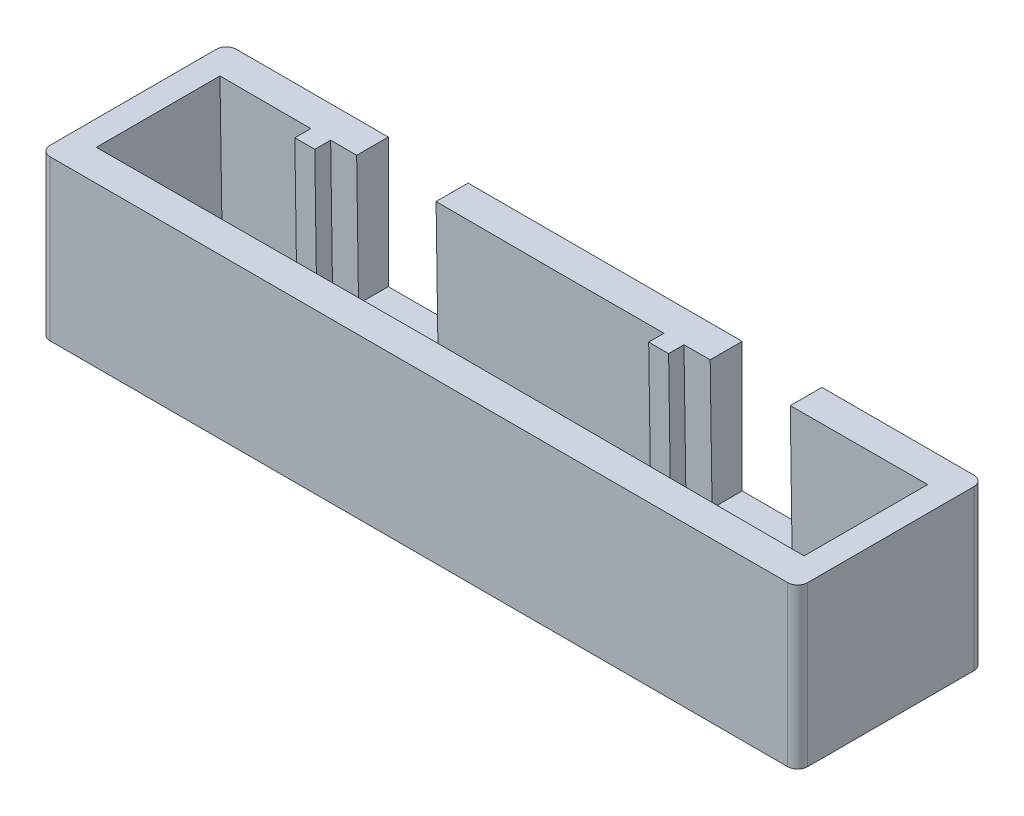
from build123d import *

# Parameters (mm, degrees)
SKETCH15_W              = 38
SKETCH15_H              = 9.34
BOSS_EXTRUDE11_DEPTH    = 1.5
SKETCH16_W              = 38
SKETCH16_H              = 9.34
BOSS_EXTRUDE12_DEPTH    = 6.5
LPATTERN2_COUNT         = 2
LPATTERN2_PITCH         = 17.75
SKETCH10_W              = 4
SKETCH10_H              = 2
CUT_EXTRUDE2_DEPTH      = 6.5
SKETCH2_W               = 0.8
SKETCH2_H               = 0.8
CUT_EXTRUDE1_DEPTH      = 21.61695676
LPATTERN1_COUNT         = 5
LPATTERN1_PITCH         = 2.54
LPATTERN1_COUNT_DIR2    = 2
LPATTERN1_PITCH_DIR2    = 2.54
MIRROR1_COPY_1_SKETCH_W = 0.8
MIRROR1_COPY_1_SKETCH_H = 0.8
MIRROR1_COPY_1_DEPTH    = 21.61695676
MIRROR1_COPY_2_SKETCH_W = 0.8
MIRROR1_COPY_2_SKETCH_H = 0.8
MIRROR1_COPY_2_DEPTH    = 21.61695676
MIRROR1_COPY_3_SKETCH_W = 0.8
MIRROR1_COPY_3_SKETCH_H = 0.8
MIRROR1_COPY_3_DEPTH    = 21.61695676
MIRROR1_COPY_4_SKETCH_W = 0.8
MIRROR1_COPY_4_SKETCH_H = 0.8
MIRROR1_COPY_4_DEPTH    = 21.61695676
MIRROR1_COPY_5_SKETCH_W = 0.8
MIRROR1_COPY_5_SKETCH_H = 0.8
MIRROR1_COPY_5_DEPTH    = 21.61695676
MIRROR1_COPY_6_SKETCH_W = 0.8
MIRROR1_COPY_6_SKETCH_H = 0.8
MIRROR1_COPY_6_DEPTH    = 21.61695676
MIRROR1_COPY_7_SKETCH_W = 0.8
MIRROR1_COPY_7_SKETCH_H = 0.8
MIRROR1_COPY_7_DEPTH    = 21.61695676
MIRROR1_COPY_8_SKETCH_W = 0.8
MIRROR1_COPY_8_SKETCH_H = 0.8
MIRROR1_COPY_8_DEPTH    = 21.61695676
MIRROR1_COPY_9_SKETCH_W = 0.8
MIRROR1_COPY_9_SKETCH_H = 0.8
MIRROR1_COPY_9_DEPTH    = 21.61695676
FILLET6_R               = 0.5


with BuildPart() as part:
    # Sketch15 → Boss-Extrude11 (new body)
    with BuildSketch(Plane(origin=(0, 0, 0), x_dir=(1, 0, 0), z_dir=(0, 1, 0))):
        Rectangle(SKETCH15_W, SKETCH15_H)
    extrude(amount=BOSS_EXTRUDE11_DEPTH)

    # Sketch16 → Boss-Extrude12 (add)
    with BuildSketch(Plane(origin=(0, 1.5, 0), x_dir=(1, 0, 0), z_dir=(0, 1, 0))):
        Rectangle(SKETCH16_W, SKETCH16_H)
    extrude(amount=BOSS_EXTRUDE12_DEPTH)

    # Sketch5 → Cut-Loft1 section 0
    with BuildSketch(Plane(origin=(0, 1.5, 0), x_dir=(1, 0, 0), z_dir=(0, 1, 0))):
        with BuildLine():
            Line((-17.75, 3.2), (-17.75, -3.2))
            add(Edge.make_bspline(
                [(-17.75, -3.2), (-14.75, -3.2), (0, -3.1), (14.75, -3.2), (17.75, -3.2)],
                knots=[0, 0, 0, 0, 0.5, 1, 1, 1, 1], degree=3))
            Line((17.75, -3.2), (17.75, 3.2))
            add(Edge.make_bspline(
                [(-17.75, 3.2), (-14.75, 3.2), (0, 3.1), (14.75, 3.2), (17.75, 3.2)],
                knots=[0, 0, 0, 0, 0.5, 1, 1, 1, 1], degree=3))
        make_face()
    # Sketch6 → Cut-Loft1 section 1
    with BuildSketch(Plane(origin=(0, 8, 0), x_dir=(1, 0, 0), z_dir=(0, 1, 0))):
        with BuildLine():
            Line((-17.75, 3.1), (-17.75, -3.1))
            add(Edge.make_bspline(
                [(-17.75, -3.1), (-11.833239437, -3.1), (0.000187784, -3), (11.832863868, -3.1), (17.75, -3.1)],
                knots=[0, 0, 0, 0, 0.5, 1, 1, 1, 1], degree=3))
            Line((17.75, -3.1), (17.75, 3.1))
            add(Edge.make_bspline(
                [(-17.75, 3.1), (-11.833239437, 3.1), (0.000187784, 3), (11.832863868, 3.1), (17.75, 3.1)],
                knots=[0, 0, 0, 0, 0.5, 1, 1, 1, 1], degree=3))
        make_face()
    loft(mode=Mode.SUBTRACT)

    # Sketch8 → Loft1 section 0
    with BuildSketch(Plane(origin=(0, 1.5, 0), x_dir=(1, 0, 0), z_dir=(0, 1, 0))):
        with BuildLine():
            Line((-13.185, 2.385934046), (-12.185, 2.385934046))
            Line((-12.185, 2.385934046), (-12.185, 3.585934046))
            Line((-12.185, 3.585934046), (-13.185, 3.585934046))
            Line((-13.185, 3.585934046), (-13.185, 2.385934046))
        make_face()
    # Sketch9 → Loft1 section 1
    with BuildSketch(Plane(origin=(0, 8, 0), x_dir=(1, 0, 0), z_dir=(0, 1, 0))):
        with BuildLine():
            Line((-13.185, 3.491779814), (-13.185, 2.291779814))
            Line((-13.185, 2.291779814), (-12.185, 2.291779814))
            Line((-12.185, 2.291779814), (-12.185, 3.491779814))
            Line((-12.185, 3.491779814), (-13.185, 3.491779814))
        make_face()
    loft1 = loft()

    # LPattern2: Loft1 ×2
    with Locations(*[(i * LPATTERN2_PITCH, 0, 0) for i in range(1, LPATTERN2_COUNT)]):
        add(loft1)

    # Sketch10 → Cut-Extrude2 (cut)
    with BuildSketch(Plane(origin=(0, 8, 0), x_dir=(1, 0, 0), z_dir=(0, 1, 0))):
        with Locations((-8.875, 3.67)):
            Rectangle(SKETCH10_W, SKETCH10_H)
        with Locations((8.875, 3.67)):
            Rectangle(SKETCH10_W, SKETCH10_H)
    extrude(amount=-CUT_EXTRUDE2_DEPTH, mode=Mode.SUBTRACT)

    # Sketch2 → Cut-Extrude1 (cut, through all)
    with BuildSketch(Plane(origin=(0, 1.5, 0), x_dir=(1, 0, 0), z_dir=(0, 1, 0))):
        with Locations((-3.795, -1.27)):
            Rectangle(SKETCH2_W, SKETCH2_H)
    cut_extrude1 = extrude(amount=-CUT_EXTRUDE1_DEPTH, mode=Mode.SUBTRACT)

    # LPattern1: Cut-Extrude1 5 × 2
    with Locations(*[(-i * LPATTERN1_PITCH, 0, -j * LPATTERN1_PITCH_DIR2) for i in range(LPATTERN1_COUNT) for j in range(LPATTERN1_COUNT_DIR2) if (i, j) != (0, 0)]):
        add(cut_extrude1, mode=Mode.SUBTRACT)

    # Mirror1: Cut-Extrude1 across plane
    add(cut_extrude1.mirror(Plane(origin=(0, 0, 0), x_dir=(0, 0, 1), z_dir=(1, 0, 0))), mode=Mode.SUBTRACT)

    # Mirror1 copy 1 sketch → Mirror1 copy 1 (cut, through all)
    with BuildSketch(Plane(origin=(0, 1.5, -2.54), x_dir=(-1, 0, 0), z_dir=(0, 1, 0))):
        with Locations((-3.795, 1.27)):
            Rectangle(MIRROR1_COPY_1_SKETCH_W, MIRROR1_COPY_1_SKETCH_H)
    extrude(amount=-MIRROR1_COPY_1_DEPTH, mode=Mode.SUBTRACT)

    # Mirror1 copy 2 sketch → Mirror1 copy 2 (cut, through all)
    with BuildSketch(Plane(origin=(2.54, 1.5, 0), x_dir=(-1, 0, 0), z_dir=(0, 1, 0))):
        with Locations((-3.795, 1.27)):
            Rectangle(MIRROR1_COPY_2_SKETCH_W, MIRROR1_COPY_2_SKETCH_H)
    extrude(amount=-MIRROR1_COPY_2_DEPTH, mode=Mode.SUBTRACT)

    # Mirror1 copy 3 sketch → Mirror1 copy 3 (cut, through all)
    with BuildSketch(Plane(origin=(2.54, 1.5, -2.54), x_dir=(-1, 0, 0), z_dir=(0, 1, 0))):
        with Locations((-3.795, 1.27)):
            Rectangle(MIRROR1_COPY_3_SKETCH_W, MIRROR1_COPY_3_SKETCH_H)
    extrude(amount=-MIRROR1_COPY_3_DEPTH, mode=Mode.SUBTRACT)

    # Mirror1 copy 4 sketch → Mirror1 copy 4 (cut, through all)
    with BuildSketch(Plane(origin=(5.08, 1.5, 0), x_dir=(-1, 0, 0), z_dir=(0, 1, 0))):
        with Locations((-3.795, 1.27)):
            Rectangle(MIRROR1_COPY_4_SKETCH_W, MIRROR1_COPY_4_SKETCH_H)
    extrude(amount=-MIRROR1_COPY_4_DEPTH, mode=Mode.SUBTRACT)

    # Mirror1 copy 5 sketch → Mirror1 copy 5 (cut, through all)
    with BuildSketch(Plane(origin=(5.08, 1.5, -2.54), x_dir=(-1, 0, 0), z_dir=(0, 1, 0))):
        with Locations((-3.795, 1.27)):
            Rectangle(MIRROR1_COPY_5_SKETCH_W, MIRROR1_COPY_5_SKETCH_H)
    extrude(amount=-MIRROR1_COPY_5_DEPTH, mode=Mode.SUBTRACT)

    # Mirror1 copy 6 sketch → Mirror1 copy 6 (cut, through all)
    with BuildSketch(Plane(origin=(7.62, 1.5, 0), x_dir=(-1, 0, 0), z_dir=(0, 1, 0))):
        with Locations((-3.795, 1.27)):
            Rectangle(MIRROR1_COPY_6_SKETCH_W, MIRROR1_COPY_6_SKETCH_H)
    extrude(amount=-MIRROR1_COPY_6_DEPTH, mode=Mode.SUBTRACT)

    # Mirror1 copy 7 sketch → Mirror1 copy 7 (cut, through all)
    with BuildSketch(Plane(origin=(7.62, 1.5, -2.54), x_dir=(-1, 0, 0), z_dir=(0, 1, 0))):
        with Locations((-3.795, 1.27)):
            Rectangle(MIRROR1_COPY_7_SKETCH_W, MIRROR1_COPY_7_SKETCH_H)
    extrude(amount=-MIRROR1_COPY_7_DEPTH, mode=Mode.SUBTRACT)

    # Mirror1 copy 8 sketch → Mirror1 copy 8 (cut, through all)
    with BuildSketch(Plane(origin=(10.16, 1.5, 0), x_dir=(-1, 0, 0), z_dir=(0, 1, 0))):
        with Locations((-3.795, 1.27)):
            Rectangle(MIRROR1_COPY_8_SKETCH_W, MIRROR1_COPY_8_SKETCH_H)
    extrude(amount=-MIRROR1_COPY_8_DEPTH, mode=Mode.SUBTRACT)

    # Mirror1 copy 9 sketch → Mirror1 copy 9 (cut, through all)
    with BuildSketch(Plane(origin=(10.16, 1.5, -2.54), x_dir=(-1, 0, 0), z_dir=(0, 1, 0))):
        with Locations((-3.795, 1.27)):
            Rectangle(MIRROR1_COPY_9_SKETCH_W, MIRROR1_COPY_9_SKETCH_H)
    extrude(amount=-MIRROR1_COPY_9_DEPTH, mode=Mode.SUBTRACT)

    # Fillet6
    fillet6_edges = [part.edges().sort_by_distance(p)[0] for p in [
        (-19, 4, -4.67),
        (19, 4, -4.67),
        (19, 4, 4.67),
        (-19, 4, 4.67),
    ]]
    fillet(fillet6_edges, radius=FILLET6_R)


solid = part.part
